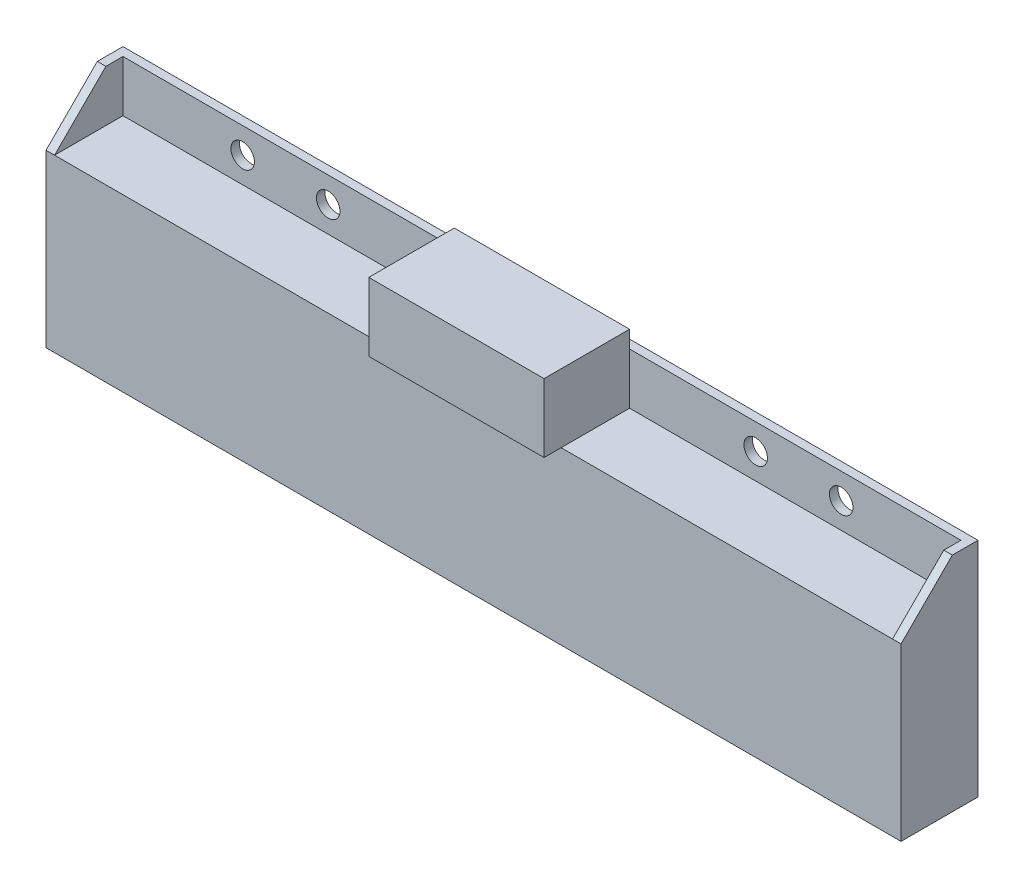
from build123d import *

# Parameters (mm, degrees)
SKETCH_1_W          = 200
SKETCH_1_H          = 52
EXTRUDE_1_DEPTH     = 18
CUT_EXTRUDE_1_DEPTH = 203.484567313
SKETCH_3_W          = 196
SKETCH_3_H          = 12
CUT_EXTRUDE_2_DEPTH = 16
HOLE_WIZARD_M5_1_D  = 5.5
SKETCH_6_W          = 41
SKETCH_6_H          = 16
EXTRUDE_2_DEPTH     = 20


with BuildPart() as part:
    # 草图1 → 凸台-拉伸1 (new body)
    with BuildSketch(Plane.XY):
        Rectangle(SKETCH_1_W, SKETCH_1_H)
    extrude(amount=EXTRUDE_1_DEPTH)

    # 草图2 → 切除-拉伸1 (cut, through all)
    with BuildSketch(Plane.ZY.offset(100)):
        Polygon((18, 14), (6, 26), (18, 26), align=None)
    extrude(amount=-CUT_EXTRUDE_1_DEPTH, mode=Mode.SUBTRACT)

    # 草图3 → 切除-拉伸2 (cut)
    with BuildSketch(Plane.XY.offset(18)):
        with Locations((0, 20)):
            Rectangle(SKETCH_3_W, SKETCH_3_H)
    extrude(amount=-CUT_EXTRUDE_2_DEPTH, mode=Mode.SUBTRACT)

    # M5 间隙孔1 (through all)
    with Locations(Plane.XY.offset(2)):
        with Locations((-50, 20), (50, 20), (70, 20), (-70, 20)):
            Hole(HOLE_WIZARD_M5_1_D / 2)

    # 草图6 → 凸台-拉伸2 (add)
    with BuildSketch(Plane.XY.offset(2)):
        with Locations((0, 22)):
            Rectangle(SKETCH_6_W, SKETCH_6_H)
    extrude(amount=EXTRUDE_2_DEPTH)


solid = part.part
